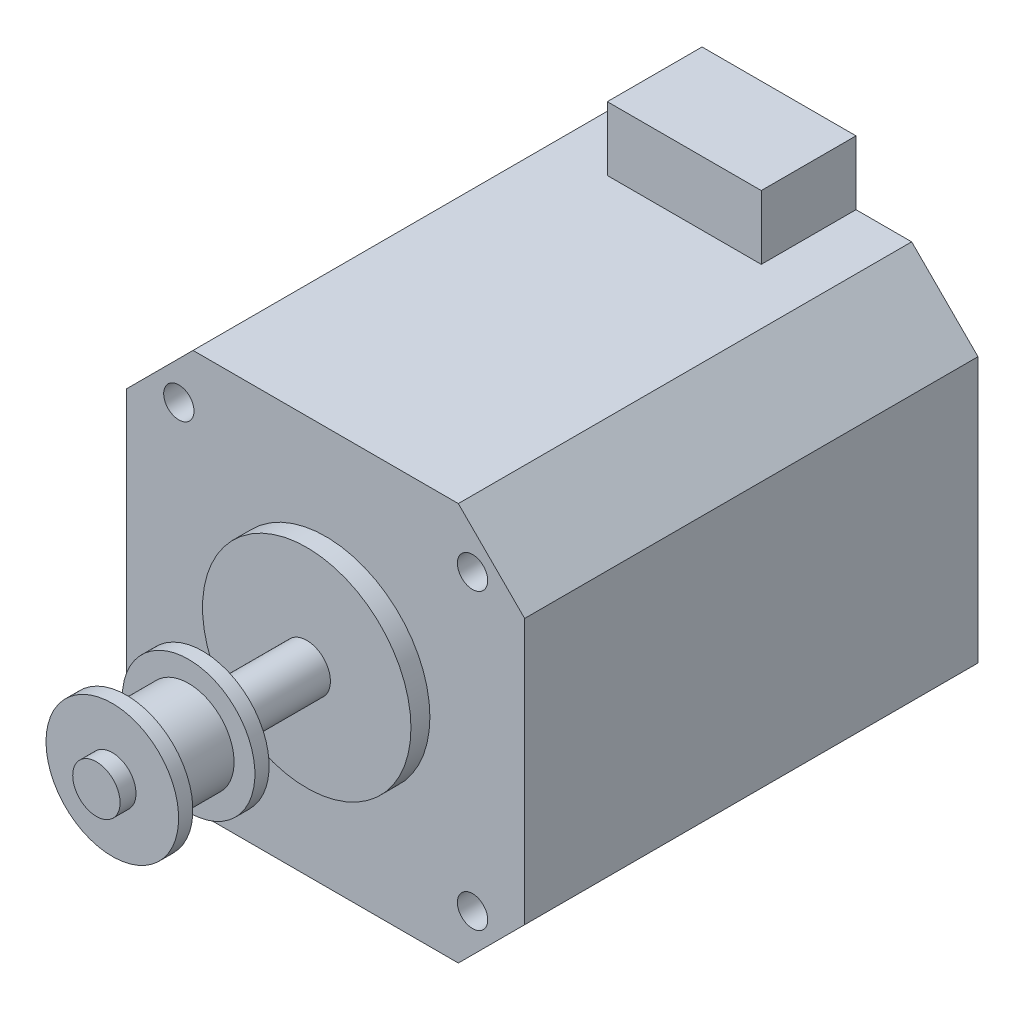
from build123d import *

# Parameters (mm, degrees)
SKETCH1_W           = 42
SKETCH1_H           = 42
BOSS_EXTRUDE1_DEPTH = 47.85
CHAMFER1_SIZE       = 7
SKETCH2_R           = 11
BOSS_EXTRUDE2_DEPTH = 2
SKETCH3_W           = 16.25
SKETCH3_H           = 6.75
BOSS_EXTRUDE3_DEPTH = 10
SKETCH4_R           = 1.6
CUT_EXTRUDE1_DEPTH  = 3


with BuildPart() as part:
    # Sketch1 → Boss-Extrude1 (new body)
    with BuildSketch(Plane.XY):
        with Locations((21, 21)):
            Rectangle(SKETCH1_W, SKETCH1_H)
    extrude(amount=BOSS_EXTRUDE1_DEPTH)

    # Chamfer1
    chamfer1_edges = [part.edges().sort_by_distance(p)[0] for p in [
        (0, 42, 23.925),
        (42, 42, 23.925),
        (42, 0, 23.925),
        (0, 0, 23.925),
    ]]
    chamfer(chamfer1_edges, length=CHAMFER1_SIZE)

    # Sketch2 → Boss-Extrude2 (add)
    with BuildSketch(Plane.XY.offset(47.85)):
        with Locations((21, 21)):
            Circle(SKETCH2_R)
    extrude(amount=BOSS_EXTRUDE2_DEPTH)

    # Sketch3 → Boss-Extrude3 (add)
    with BuildSketch(Plane(origin=(0, 0, 0), x_dir=(-1, 0, 0), z_dir=(0, 0, -1))):
        with Locations((-21, 45.375)):
            Rectangle(SKETCH3_W, SKETCH3_H)
    extrude(amount=-BOSS_EXTRUDE3_DEPTH)

    # Sketch4 → Cut-Extrude1 (cut)
    with BuildSketch(Plane.XY.offset(47.85)):
        with Locations((5.5, 36.5)):
            Circle(SKETCH4_R)
        with Locations((36.5, 36.5)):
            Circle(SKETCH4_R)
        with Locations((36.5, 5.5)):
            Circle(SKETCH4_R)
        with Locations((5.5, 5.5)):
            Circle(SKETCH4_R)
    extrude(amount=-CUT_EXTRUDE1_DEPTH, mode=Mode.SUBTRACT)

    # Sketch5 → Revolve1 (revolve)
    with BuildSketch(Plane(origin=(0, 21, 0), x_dir=(-1, 0, 0), z_dir=(0, -1, 0))):
        Polygon((-18.5, -49.85), (-21, -49.85), (-21, -72.05), (-18.5, -72.05), (-18.5, -70.37), (-14, -70.37), (-14, -68.87), (-16.2, -68.87), (-16.2, -62.32), (-14, -62.32), (-14, -60.82), (-18.5, -60.82), align=None)
    revolve(axis=Axis((21, 21, 49.85), (0, 0, 1)))


solid = part.part
